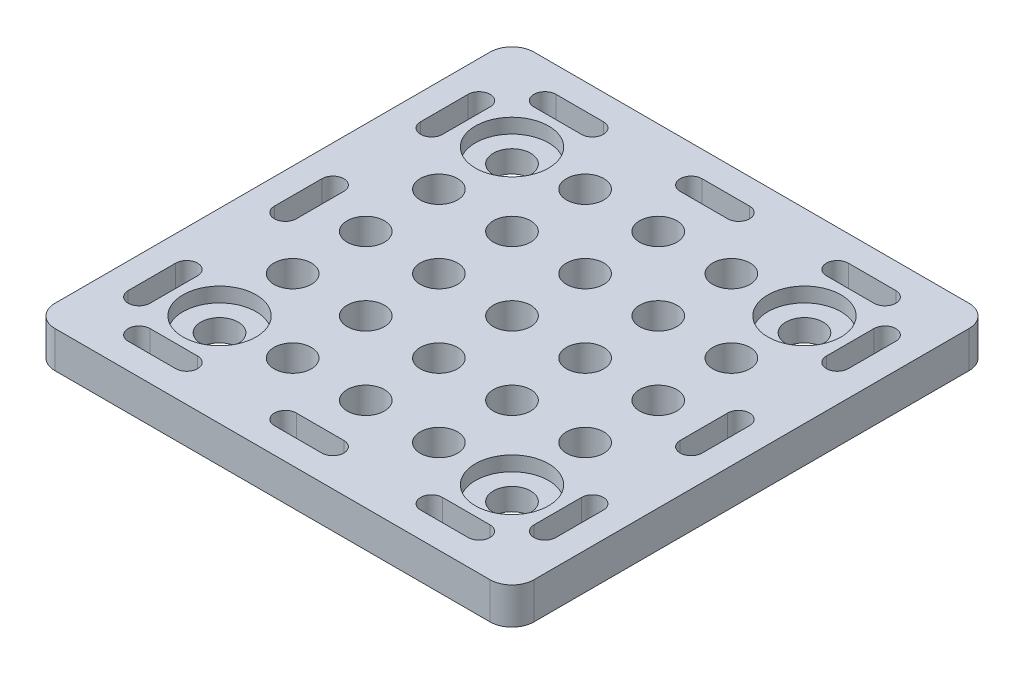
from build123d import *

# Parameters (mm, degrees)
SKETCH1_R           = 2.55
BOSS_EXTRUDE1_DEPTH = 5
SKETCH_4_R          = 5
CUT_EXTRUDE_1_DEPTH = 2


with BuildPart() as part:
    # Sketch1 → Boss-Extrude1 (new body)
    with BuildSketch(Plane(origin=(0, 0, 0), x_dir=(1, 0, 0), z_dir=(0, 1, 0))):
        with BuildLine():
            Line((29.75, -32.75), (-29.75, -32.75))
            ThreePointArc((-29.75, -32.75), (-31.871320344, -31.871320344), (-32.75, -29.75))
            Line((-32.75, -29.75), (-32.75, 29.75))
            ThreePointArc((-32.75, 29.75), (-31.871320344, 31.871320344), (-29.75, 32.75))
            Line((-29.75, 32.75), (29.75, 32.75))
            ThreePointArc((29.75, 32.75), (31.871320344, 31.871320344), (32.75, 29.75))
            Line((32.75, 29.75), (32.75, -29.75))
            ThreePointArc((32.75, -29.75), (31.871320344, -31.871320344), (29.75, -32.75))
        make_face()
        with Locations(Location((0, 0, 0), (0, 0, 270))):
            Circle(SKETCH1_R, mode=Mode.SUBTRACT)
        with Locations(Location((10, -10, 0), (0, 0, 270))):
            Circle(SKETCH1_R, mode=Mode.SUBTRACT)
        with Locations(Location((20, -10, 0), (0, 0, 270))):
            Circle(SKETCH1_R, mode=Mode.SUBTRACT)
        with Locations(Location((10, -20, 0), (0, 0, 270))):
            Circle(SKETCH1_R, mode=Mode.SUBTRACT)
        with Locations(Location((20, -20, 0), (0, 0, 270))):
            Circle(SKETCH1_R, mode=Mode.SUBTRACT)
        with Locations(Location((-10, -10, 0), (0, 0, 270))):
            Circle(SKETCH1_R, mode=Mode.SUBTRACT)
        with Locations(Location((-20, -10, 0), (0, 0, 270))):
            Circle(SKETCH1_R, mode=Mode.SUBTRACT)
        with Locations(Location((-10, -20, 0), (0, 0, 270))):
            Circle(SKETCH1_R, mode=Mode.SUBTRACT)
        with Locations(Location((-20, -20, 0), (0, 0, 270))):
            Circle(SKETCH1_R, mode=Mode.SUBTRACT)
        with Locations(Location((0, -10, 0), (0, 0, 270))):
            Circle(SKETCH1_R, mode=Mode.SUBTRACT)
        with Locations(Location((0, -20, 0), (0, 0, 270))):
            Circle(SKETCH1_R, mode=Mode.SUBTRACT)
        with Locations(Location((10, 0, 0), (0, 0, 270))):
            Circle(SKETCH1_R, mode=Mode.SUBTRACT)
        with Locations(Location((20, 0, 0), (0, 0, 270))):
            Circle(SKETCH1_R, mode=Mode.SUBTRACT)
        with Locations(Location((10, 10, 0), (0, 0, 270))):
            Circle(SKETCH1_R, mode=Mode.SUBTRACT)
        with Locations(Location((20, 10, 0), (0, 0, 270))):
            Circle(SKETCH1_R, mode=Mode.SUBTRACT)
        with Locations(Location((10, 20, 0), (0, 0, 270))):
            Circle(SKETCH1_R, mode=Mode.SUBTRACT)
        with Locations(Location((20, 20, 0), (0, 0, 270))):
            Circle(SKETCH1_R, mode=Mode.SUBTRACT)
        with Locations(Location((-10, 0, 0), (0, 0, 270))):
            Circle(SKETCH1_R, mode=Mode.SUBTRACT)
        with Locations(Location((-20, 0, 0), (0, 0, 270))):
            Circle(SKETCH1_R, mode=Mode.SUBTRACT)
        with Locations(Location((-10, 10, 0), (0, 0, 270))):
            Circle(SKETCH1_R, mode=Mode.SUBTRACT)
        with Locations(Location((-20, 10, 0), (0, 0, 270))):
            Circle(SKETCH1_R, mode=Mode.SUBTRACT)
        with Locations(Location((-10, 20, 0), (0, 0, 270))):
            Circle(SKETCH1_R, mode=Mode.SUBTRACT)
        with Locations(Location((-20, 20, 0), (0, 0, 270))):
            Circle(SKETCH1_R, mode=Mode.SUBTRACT)
        with Locations(Location((0, 10, 0), (0, 0, 270))):
            Circle(SKETCH1_R, mode=Mode.SUBTRACT)
        with Locations(Location((0, 20, 0), (0, 0, 270))):
            Circle(SKETCH1_R, mode=Mode.SUBTRACT)
        with BuildLine():
            Line((-29.25, 16.75), (-29.25, 23.25))
            ThreePointArc((-29.25, 23.25), (-27.75, 24.75), (-26.25, 23.25))
            Line((-26.25, 23.25), (-26.25, 16.75))
            ThreePointArc((-26.25, 16.75), (-27.75, 15.25), (-29.25, 16.75))
        make_face(mode=Mode.SUBTRACT)
        with BuildLine():
            Line((26.25, 16.75), (26.25, 23.25))
            ThreePointArc((26.25, 23.25), (27.75, 24.75), (29.25, 23.25))
            Line((29.25, 23.25), (29.25, 16.75))
            ThreePointArc((29.25, 16.75), (27.75, 15.25), (26.25, 16.75))
        make_face(mode=Mode.SUBTRACT)
        with BuildLine():
            Line((3.25, 26.25), (-3.25, 26.25))
            ThreePointArc((-3.25, 26.25), (-4.75, 27.75), (-3.25, 29.25))
            Line((-3.25, 29.25), (3.25, 29.25))
            ThreePointArc((3.25, 29.25), (4.75, 27.75), (3.25, 26.25))
        make_face(mode=Mode.SUBTRACT)
        with BuildLine():
            Line((-16.75, 26.25), (-23.25, 26.25))
            ThreePointArc((-23.25, 26.25), (-24.75, 27.75), (-23.25, 29.25))
            Line((-23.25, 29.25), (-16.75, 29.25))
            ThreePointArc((-16.75, 29.25), (-15.25, 27.75), (-16.75, 26.25))
        make_face(mode=Mode.SUBTRACT)
        with BuildLine():
            Line((16.75, 26.25), (23.25, 26.25))
            ThreePointArc((23.25, 26.25), (24.75, 27.75), (23.25, 29.25))
            Line((23.25, 29.25), (16.75, 29.25))
            ThreePointArc((16.75, 29.25), (15.25, 27.75), (16.75, 26.25))
        make_face(mode=Mode.SUBTRACT)
        with BuildLine():
            Line((26.25, -3.25), (26.25, 3.25))
            ThreePointArc((26.25, 3.25), (27.75, 4.75), (29.25, 3.25))
            Line((29.25, 3.25), (29.25, -3.25))
            ThreePointArc((29.25, -3.25), (27.75, -4.75), (26.25, -3.25))
        make_face(mode=Mode.SUBTRACT)
        with BuildLine():
            Line((-16.75, -26.25), (-23.25, -26.25))
            ThreePointArc((-23.25, -26.25), (-24.75, -27.75), (-23.25, -29.25))
            Line((-23.25, -29.25), (-16.75, -29.25))
            ThreePointArc((-16.75, -29.25), (-15.25, -27.75), (-16.75, -26.25))
        make_face(mode=Mode.SUBTRACT)
        with BuildLine():
            Line((3.25, -26.25), (-3.25, -26.25))
            ThreePointArc((-3.25, -26.25), (-4.75, -27.75), (-3.25, -29.25))
            Line((-3.25, -29.25), (3.25, -29.25))
            ThreePointArc((3.25, -29.25), (4.75, -27.75), (3.25, -26.25))
        make_face(mode=Mode.SUBTRACT)
        with BuildLine():
            Line((16.75, -26.25), (23.25, -26.25))
            ThreePointArc((23.25, -26.25), (24.75, -27.75), (23.25, -29.25))
            Line((23.25, -29.25), (16.75, -29.25))
            ThreePointArc((16.75, -29.25), (15.25, -27.75), (16.75, -26.25))
        make_face(mode=Mode.SUBTRACT)
        with BuildLine():
            Line((26.25, -23.25), (26.25, -16.75))
            ThreePointArc((26.25, -16.75), (27.75, -15.25), (29.25, -16.75))
            Line((29.25, -16.75), (29.25, -23.25))
            ThreePointArc((29.25, -23.25), (27.75, -24.75), (26.25, -23.25))
        make_face(mode=Mode.SUBTRACT)
        with BuildLine():
            Line((-29.25, -3.25), (-29.25, 3.25))
            ThreePointArc((-29.25, 3.25), (-27.75, 4.75), (-26.25, 3.25))
            Line((-26.25, 3.25), (-26.25, -3.25))
            ThreePointArc((-26.25, -3.25), (-27.75, -4.75), (-29.25, -3.25))
        make_face(mode=Mode.SUBTRACT)
        with BuildLine():
            Line((-29.25, -23.25), (-29.25, -16.75))
            ThreePointArc((-29.25, -16.75), (-27.75, -15.25), (-26.25, -16.75))
            Line((-26.25, -16.75), (-26.25, -23.25))
            ThreePointArc((-26.25, -23.25), (-27.75, -24.75), (-29.25, -23.25))
        make_face(mode=Mode.SUBTRACT)
    extrude(amount=BOSS_EXTRUDE1_DEPTH)

    # 草圖4 → 除料-伸長1 (cut)
    with BuildSketch(Plane(origin=(0, 5, 0), x_dir=(1, 0, 0), z_dir=(0, 1, 0))):
        with Locations(Location((-20, -20, 0), (0, 0, 270))):
            Circle(SKETCH_4_R)
        with Locations(Location((20, -20, 0), (0, 0, 270))):
            Circle(SKETCH_4_R)
        with Locations(Location((20, 20, 0), (0, 0, 270))):
            Circle(SKETCH_4_R)
        with Locations(Location((-20, 20, 0), (0, 0, 270))):
            Circle(SKETCH_4_R)
    extrude(amount=-CUT_EXTRUDE_1_DEPTH, mode=Mode.SUBTRACT)


solid = part.part
